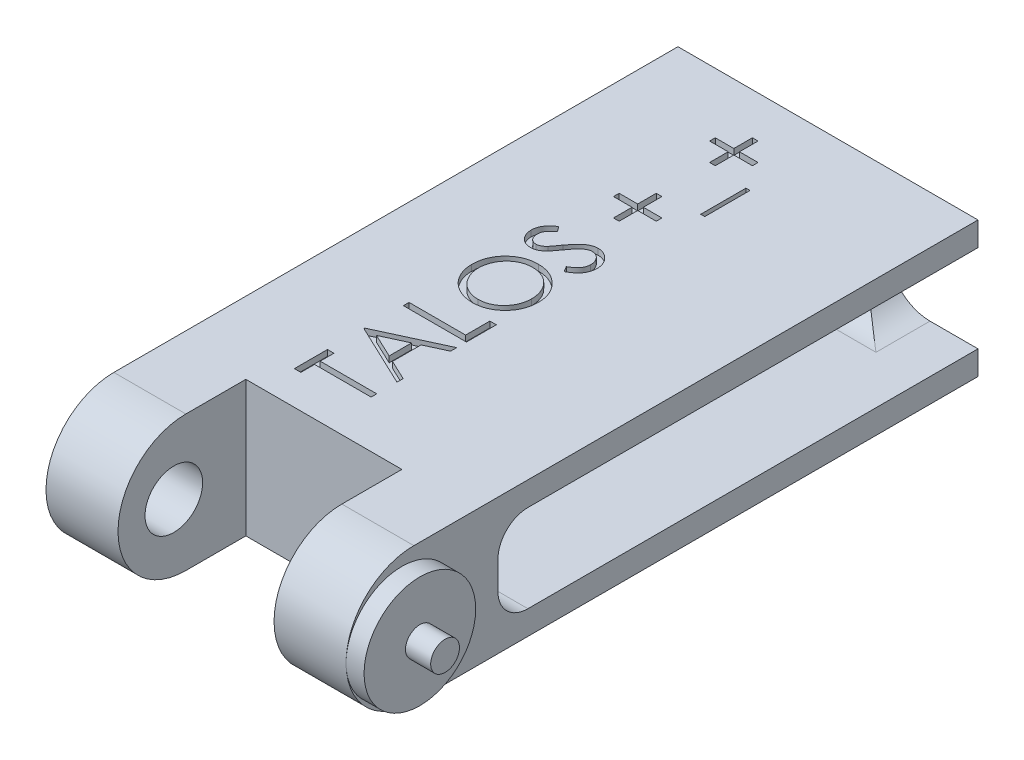
from build123d import *

# Parameters (mm, degrees)
SKETCH1_W           = 20
SKETCH1_H           = 14.6
SKETCH1_R           = 1.65
BOSS_EXTRUDE1_DEPTH = 4
SKETCH2_W           = 50
SKETCH2_H           = 80
BOSS_EXTRUDE2_DEPTH = 4
SKETCH3_W           = 50
SKETCH3_H           = 22.6
BOSS_EXTRUDE3_DEPTH = 4
SKETCH4_R           = 4.8
BOSS_EXTRUDE4_DEPTH = 12
SKETCH5_R           = 9.3
BOSS_EXTRUDE5_DEPTH = 3
SKETCH6_R           = 2.4
BOSS_EXTRUDE6_DEPTH = 4.2
FILLET1_R           = 7
FILLET2_R           = 5
FILLET3_R           = 5
SKETCH7_W           = 0.673076923
SKETCH7_H           = 7.538461539
CUT_EXTRUDE1_DEPTH  = 1


with BuildPart() as part:
    # Sketch1 → Boss-Extrude1 (new body)
    with BuildSketch(Plane.XY):
        Rectangle(SKETCH1_W, SKETCH1_H)
        with Locations((-6, 0)):
            Circle(SKETCH1_R, mode=Mode.SUBTRACT)
        with Locations((6, 0)):
            Circle(SKETCH1_R, mode=Mode.SUBTRACT)
    extrude(amount=BOSS_EXTRUDE1_DEPTH)

    # Sketch2 → Boss-Extrude2 (add)
    with BuildSketch(Plane.XZ.offset(7.3)):
        with Locations((0, 40)):
            Rectangle(SKETCH2_W, SKETCH2_H)
    boss_extrude2 = extrude(amount=BOSS_EXTRUDE2_DEPTH)

    # Mirror1: Boss-Extrude2 across plane
    add(boss_extrude2.mirror(Plane.ZX))

    # Sketch3 → Boss-Extrude3 (add)
    with BuildSketch(Plane.XY.offset(80)):
        Rectangle(SKETCH3_W, SKETCH3_H)
    extrude(amount=BOSS_EXTRUDE3_DEPTH)

    # Sketch4 → Boss-Extrude4 (add)
    with BuildSketch(Plane(origin=(25, 0, 0), x_dir=(0, 0, -1), z_dir=(1, 0, 0))):
        with BuildLine():
            Line((-84, 11.3), (-94, 11.3))
            ThreePointArc((-94, 11.3), (-105.3, 0), (-94, -11.3))
            Line((-94, -11.3), (-84, -11.3))
            Line((-84, -11.3), (-84, 11.3))
        make_face()
        with Locations((-96, 0)):
            Circle(SKETCH4_R, mode=Mode.SUBTRACT)
    boss_extrude4 = extrude(amount=-BOSS_EXTRUDE4_DEPTH)

    # Mirror2: Boss-Extrude4 across plane
    add(boss_extrude4.mirror(Plane(origin=(0, 0, 0), x_dir=(0, 0, 1), z_dir=(1, 0, 0))))

    # Sketch5 → Boss-Extrude5 (add)
    with BuildSketch(Plane(origin=(25, 0, 0), x_dir=(0, 0, -1), z_dir=(1, 0, 0))):
        with Locations(Location((-96, 0, 0), (0, 0, 179.999368251))):
            Circle(SKETCH5_R)
    extrude(amount=BOSS_EXTRUDE5_DEPTH)

    # Sketch6 → Boss-Extrude6 (add)
    with BuildSketch(Plane(origin=(28, 0, 0), x_dir=(0, 0, -1), z_dir=(1, 0, 0))):
        with Locations((-96, 0)):
            Circle(SKETCH6_R)
    extrude(amount=BOSS_EXTRUDE6_DEPTH)

    # Fillet1
    fillet1_edges = [part.edges().sort_by_distance(p)[0] for p in [
        (10, -7.3, 2),
        (-10, -7.3, 2),
        (-10, 7.3, 2),
        (10, 7.3, 2),
    ]]
    fillet(fillet1_edges, radius=FILLET1_R)

    # Fillet2
    fillet2_edges = [part.edges().sort_by_distance(p)[0] for p in [
        (0, -7.3, 4),
        (0, 7.3, 4),
    ]]
    fillet(fillet2_edges, radius=FILLET2_R)

    # Fillet3
    fillet3_edges = [part.edges().sort_by_distance(p)[0] for p in [
        (0, -7.3, 80),
        (0, 7.3, 80),
    ]]
    fillet(fillet3_edges, radius=FILLET3_R)

    # Sketch7 → Cut-Extrude1 (cut)
    # profile 1 of 8: a face of its own
    with BuildSketch(Plane(origin=(0, 11.3, 0), x_dir=(1, 0, 0), z_dir=(0, 1, 0))):
        Polygon((-9.423076923, -78.41591684), (-10.5, -78.41591684), (-10.5, -72.896686071), (-9.423076923, -72.896686071), (-9.423076923, -75.185147609), (0, -75.185147609), (0, -76.127455302), (-9.423076923, -76.127455302), align=None)
    # profile 2 of 8: a face of its own
    with BuildSketch(Plane(origin=(0, 11.3, 0), x_dir=(1, 0, 0), z_dir=(0, 1, 0))):
        Polygon((-10.5, -66.704378379), (0, -61.858224532), (0, -62.882563475), (-3.365384615, -64.434847129), (-3.365384615, -69.194762994), (0, -70.789113956), (0, -71.819762994), (-10.5, -66.838993763), align=None)
        Polygon((-8.451322115, -66.782202898), (-4.442307692, -68.68154184), (-4.442307692, -64.931241359), align=None, mode=Mode.SUBTRACT)
    # profile 3 of 8: a face of its own
    with BuildSketch(Plane(origin=(0, 11.3, 0), x_dir=(1, 0, 0), z_dir=(0, 1, 0))):
        Polygon((-10.5, -60.242839917), (-10.5, -59.300532225), (-1.076923077, -59.300532225), (-1.076923077, -55.262070686), (0, -55.262070686), (0, -60.242839917), align=None)
    # profile 4 of 8: a face of its own
    with BuildSketch(Plane(origin=(0, 11.3, 0), x_dir=(1, 0, 0), z_dir=(0, 1, 0))):
        with BuildLine():
            add(Edge.make_bspline(
                [(-10.769230769, -48.598609148), (-10.764389232, -48.404163632), (-10.754880053, -48.022256596), (-10.679685693, -47.46149203), (-10.555923645, -46.924534814), (-10.381145206, -46.411076257), (-10.154566923, -45.92306917), (-9.879339197, -45.459135291), (-9.553789417, -45.020664984), (-9.182697969, -44.610676417), (-8.77629227, -44.236671861), (-8.341227263, -43.908480922), (-7.88297286, -43.631620893), (-7.401505163, -43.404980805), (-6.897948262, -43.227053315), (-6.369479981, -43.104304818), (-5.819561625, -43.025888008), (-5.444480795, -43.016721001), (-5.254206731, -43.012070686)],
                knots=[0, 0, 0, 0, 1.065064174, 2.09187391, 3.093564831, 4.079973196, 5.057907931, 6.036227367, 7.030399151, 8.044883615, 9.061699972, 10.052012555, 11.025713132, 11.989727027, 12.962874294, 13.945865945, 14.957962116, 16, 16, 16, 16], degree=3))
            add(Edge.make_bspline(
                [(-5.254206731, -43.012070686), (-5.065335371, -43.016722566), (-4.693048039, -43.025891959), (-4.14660367, -43.104368445), (-3.621383116, -43.227601025), (-3.118557027, -43.402777821), (-2.638067209, -43.629591823), (-2.179465893, -43.906859431), (-1.743238826, -44.2344275), (-1.334033323, -44.606843841), (-0.959705032, -45.014023748), (-0.629532899, -45.447416675), (-0.35255235, -45.905658859), (-0.12338203, -46.384001553), (0.050837477, -46.886200859), (0.177675031, -47.408602264), (0.255313382, -47.954051981), (0.264540734, -48.32561713), (0.269230769, -48.514474532)],
                knots=[0, 0, 0, 0, 1.043748596, 2.057349401, 3.045489418, 4.02252776, 4.995289225, 5.97782527, 6.980224157, 8.006516136, 9.032559198, 10.034193337, 11.013412982, 11.987833483, 12.961212594, 13.946489799, 14.956251404, 16, 16, 16, 16], degree=3))
            add(Edge.make_bspline(
                [(0.269230769, -48.514474532), (0.264582609, -48.704747489), (0.255419847, -49.079826137), (0.176875632, -49.630437243), (0.054051721, -50.159270475), (-0.121476588, -50.664813529), (-0.34832828, -51.147348317), (-0.624941417, -51.607818565), (-0.95316284, -52.044376007), (-1.325662564, -52.453401247), (-1.73117722, -52.827648841), (-2.165679986, -53.153926968), (-2.620646355, -53.430602308), (-3.097338928, -53.656692306), (-3.593453256, -53.835685684), (-4.112298688, -53.957800138), (-4.650917206, -54.036807994), (-5.017645901, -54.045912534), (-5.203725962, -54.050532225)],
                knots=[0, 0, 0, 0, 1.053102029, 2.075944431, 3.073151272, 4.055350789, 5.033113405, 6.020478099, 7.024410459, 8.052272461, 9.079885166, 10.07527673, 11.055994387, 12.023226415, 12.992069828, 13.970394897, 14.97016774, 16, 16, 16, 16], degree=3))
            add(Edge.make_bspline(
                [(-5.203725962, -54.050532225), (-5.328623969, -54.048928318), (-5.576844339, -54.045740739), (-5.94544414, -54.007365662), (-6.308116113, -53.951680558), (-6.663828957, -53.871874821), (-7.011711911, -53.76749982), (-7.3541642, -53.644343737), (-7.687715371, -53.493924201), (-8.013945546, -53.323882257), (-8.327769264, -53.134096833), (-8.624408013, -52.924469585), (-8.906351003, -52.702363479), (-9.166292015, -52.458873299), (-9.411792984, -52.202023963), (-9.639081135, -51.927648829), (-9.850205988, -51.637422095), (-10.040467011, -51.330094956), (-10.212544415, -51.013240132), (-10.360209968, -50.686609798), (-10.486948153, -50.354640084), (-10.589670628, -50.01577614), (-10.670766736, -49.670917824), (-10.725988797, -49.31931247), (-10.764461751, -48.961240191), (-10.767634257, -48.720006234), (-10.769230769, -48.598609148)],
                knots=[0, 0, 0, 0, 1.037015668, 2.060948919, 3.074880161, 4.083647147, 5.086022904, 6.090072063, 7.104153813, 8.122640571, 9.144368836, 10.147691507, 11.138137339, 12.123020368, 13.103399296, 14.087645067, 15.080126199, 16.082011238, 17.087798457, 18.072939717, 19.057185487, 20.037253025, 21.01195951, 21.997135196, 22.992090687, 24, 24, 24, 24], degree=3))
        make_face()
        with BuildLine():
            add(Edge.make_bspline(
                [(-9.692307692, -48.552335109), (-9.691097258, -48.651980284), (-9.688687961, -48.850318019), (-9.656778179, -49.145152788), (-9.611624349, -49.436199527), (-9.546045155, -49.722895023), (-9.461221316, -50.005840529), (-9.358917071, -50.285161662), (-9.235267059, -50.559900722), (-9.096207597, -50.829714482), (-8.938258294, -51.088371129), (-8.770531561, -51.336493581), (-8.586795442, -51.567627964), (-8.391023509, -51.784949417), (-8.181516766, -51.987917484), (-7.959651068, -52.176442637), (-7.724466786, -52.350370279), (-7.476931803, -52.507607264), (-7.218428161, -52.647535908), (-6.953897335, -52.772819889), (-6.680230538, -52.876675529), (-6.399135533, -52.958944669), (-6.111851044, -53.028772318), (-5.81681184, -53.072573388), (-5.515035028, -53.10479758), (-5.311088303, -53.10707342), (-5.207932692, -53.108224532)],
                knots=[0, 0, 0, 0, 1.008406545, 2.007172654, 2.999155034, 3.989332444, 4.982025741, 5.988181096, 6.998684226, 8.030553839, 9.059268815, 10.065399129, 11.060956322, 12.046057109, 13.024974577, 14.012068307, 14.991706172, 15.984221787, 16.978487447, 17.966117052, 18.945677757, 19.938371053, 20.93015022, 21.936155317, 22.956113857, 24, 24, 24, 24], degree=3))
            add(Edge.make_bspline(
                [(-5.207932692, -53.108224532), (-5.056249479, -53.104391196), (-4.757841672, -53.096849838), (-4.320488036, -53.031101976), (-3.899763463, -52.929021926), (-3.498175635, -52.781025136), (-3.113933764, -52.592226027), (-2.748533179, -52.361929444), (-2.402081669, -52.088026354), (-2.07715822, -51.777079495), (-1.780705781, -51.437067301), (-1.52012253, -51.076197438), (-1.300808397, -50.697324974), (-1.117466711, -50.302633631), (-0.979344712, -49.888753605), (-0.880863792, -49.458338532), (-0.817035507, -49.011378902), (-0.810836263, -48.706801817), (-0.807692308, -48.552335109)],
                knots=[0, 0, 0, 0, 1.032022337, 2.030307203, 3.003823408, 3.974715386, 4.937372378, 5.913284036, 6.909147208, 7.938749767, 8.970518239, 9.975863271, 10.963918693, 11.946286286, 12.933361397, 13.927862637, 14.949112547, 16, 16, 16, 16], degree=3))
            add(Edge.make_bspline(
                [(-0.807692308, -48.552335109), (-0.80911767, -48.448506196), (-0.811944591, -48.242582277), (-0.840457487, -47.936301697), (-0.886089801, -47.635510591), (-0.952115465, -47.340764718), (-1.033656501, -47.051677897), (-1.134799752, -46.769122405), (-1.256046268, -46.493192091), (-1.391171499, -46.222530144), (-1.544670118, -45.963196947), (-1.710135741, -45.71657955), (-1.890629903, -45.485843375), (-2.083772536, -45.268623886), (-2.292635257, -45.067078282), (-2.513152595, -44.879089899), (-2.74883603, -44.708169515), (-2.995357169, -44.551465566), (-3.251976163, -44.409829579), (-3.517234241, -44.288169472), (-3.789708734, -44.184269224), (-4.069599836, -44.100513853), (-4.356277956, -44.034849327), (-4.650153392, -43.989611777), (-4.950631095, -43.957965864), (-5.153862707, -43.955580713), (-5.256310096, -43.954378379)],
                knots=[0, 0, 0, 0, 1.047334373, 2.07717862, 3.100662057, 4.115010574, 5.122652213, 6.129548646, 7.140165612, 8.16200981, 9.179904151, 10.178566626, 11.156366481, 12.133321541, 13.108841334, 14.082538371, 15.054589433, 16.043660176, 17.028268541, 18.009491307, 18.985652105, 19.968123554, 20.954864208, 21.950389976, 22.966808393, 24, 24, 24, 24], degree=3))
            add(Edge.make_bspline(
                [(-5.256310096, -43.954378379), (-5.358056609, -43.955581718), (-5.559889559, -43.957968762), (-5.858272014, -43.989596186), (-6.150031649, -44.034898857), (-6.434023057, -44.100186982), (-6.710318637, -44.18433744), (-6.978658863, -44.288099442), (-7.240043511, -44.410455298), (-7.493826166, -44.550880132), (-7.737351261, -44.708727002), (-7.970155229, -44.881211961), (-8.187885655, -45.071299688), (-8.395844102, -45.27360887), (-8.589870971, -45.493003461), (-8.769216575, -45.729521749), (-8.941961628, -45.977274736), (-9.094842913, -46.241865173), (-9.2367354, -46.513952478), (-9.357791469, -46.793401404), (-9.461761488, -47.076221011), (-9.546298371, -47.363542063), (-9.611373149, -47.655228752), (-9.656818587, -47.951111448), (-9.688677001, -48.250157354), (-9.691093621, -48.451289554), (-9.692307692, -48.552335109)],
                knots=[0, 0, 0, 0, 1.029877221, 2.042951179, 3.035109885, 4.018542222, 4.991021277, 5.957494829, 6.929429462, 7.911425532, 8.892163142, 9.866273635, 10.842761649, 11.81676864, 12.802607151, 13.805177466, 14.821356543, 15.858816981, 16.897175917, 17.927346774, 18.940346092, 19.946830556, 20.957962087, 21.964146003, 22.97721996, 24, 24, 24, 24], degree=3))
        make_face(mode=Mode.SUBTRACT)
    # profile 5 of 8: a face of its own
    with BuildSketch(Plane(origin=(0, 11.3, 0), x_dir=(1, 0, 0), z_dir=(0, 1, 0))):
        with BuildLine():
            Line((-2.025540865, -41.935147609), (-2.557692308, -41.047527417))
            add(Edge.make_bspline(
                [(-2.557692308, -41.047527417), (-2.419499153, -40.964972705), (-2.154726401, -40.806801063), (-1.79695228, -40.542946986), (-1.49286581, -40.269548253), (-1.244235987, -39.984580252), (-1.048489327, -39.689782408), (-0.909882632, -39.383230246), (-0.823434705, -39.065956814), (-0.812934446, -38.85003535), (-0.807692308, -38.742238956)],
                knots=[0, 0, 0, 0, 1.272034388, 2.437168799, 3.508375237, 4.49857839, 5.41946034, 6.295179144, 7.148887113, 8, 8, 8, 8], degree=3))
            add(Edge.make_bspline(
                [(-0.807692308, -38.742238956), (-0.810317324, -38.650197012), (-0.815521426, -38.467723641), (-0.86350583, -38.198566944), (-0.942008215, -37.938469913), (-1.048426697, -37.690018076), (-1.179238149, -37.45979378), (-1.333489399, -37.254672069), (-1.511721198, -37.08146853), (-1.707330898, -36.937880702), (-1.9170901, -36.826773485), (-2.133217162, -36.742797569), (-2.35867751, -36.695766534), (-2.510514979, -36.688709119), (-2.587139423, -36.685147609)],
                knots=[0, 0, 0, 0, 1.09553864, 2.171907928, 3.244545276, 4.325730702, 5.384330216, 6.391480148, 7.371786628, 8.333890167, 9.27165687, 10.191402356, 11.087295184, 12, 12, 12, 12], degree=3))
            add(Edge.make_bspline(
                [(-2.587139423, -36.685147609), (-2.674591151, -36.689475546), (-2.851690437, -36.698240091), (-3.113426688, -36.775482603), (-3.373563473, -36.893428687), (-3.534505142, -37.004284751), (-3.617788462, -37.061650013)],
                knots=[0, 0, 0, 0, 0.938992559, 1.901562324, 2.914110574, 4, 4, 4, 4], degree=3))
            add(Edge.make_bspline(
                [(-3.617788462, -37.061650013), (-3.677936536, -37.108654964), (-3.804209895, -37.207335978), (-3.992012091, -37.377129528), (-4.186122427, -37.575356348), (-4.390802305, -37.799303387), (-4.604351682, -38.049346302), (-4.828436988, -38.325581834), (-5.058479019, -38.630367494), (-5.212562677, -38.84429552), (-5.292067308, -38.954678859)],
                knots=[0, 0, 0, 0, 0.72225051, 1.516274602, 2.393638633, 3.3469932, 4.386926276, 5.505032946, 6.712638081, 8, 8, 8, 8], degree=3))
            add(Edge.make_bspline(
                [(-5.292067308, -38.954678859), (-5.370753071, -39.065150848), (-5.521194257, -39.276364878), (-5.744467109, -39.571740625), (-5.948598718, -39.835874014), (-6.135510754, -40.067591063), (-6.305228568, -40.266789854), (-6.456122386, -40.435040087), (-6.592273068, -40.568055758), (-6.680597094, -40.6420225), (-6.720252404, -40.675231744)],
                knots=[0, 0, 0, 0, 1.452282411, 2.77665338, 3.964542531, 5.026858415, 5.96415736, 6.766646006, 7.446254459, 8, 8, 8, 8], degree=3))
            add(Edge.make_bspline(
                [(-6.720252404, -40.675231744), (-6.782058582, -40.7216416), (-6.903608727, -40.812912809), (-7.093539582, -40.933521691), (-7.28759484, -41.03523149), (-7.486477799, -41.117088861), (-7.688693737, -41.183283817), (-7.895760811, -41.229306292), (-8.106273326, -41.257673573), (-8.247908924, -41.260603832), (-8.318810096, -41.262070686)],
                knots=[0, 0, 0, 0, 1.068019517, 2.100403715, 3.106014851, 4.09224787, 5.069873182, 6.043214339, 7.020455327, 8, 8, 8, 8], degree=3))
            add(Edge.make_bspline(
                [(-8.318810096, -41.262070686), (-8.429899637, -41.258155234), (-8.649704258, -41.250408018), (-8.970793598, -41.184883938), (-9.277364594, -41.081474682), (-9.566311484, -40.936554617), (-9.830374406, -40.749914963), (-10.071930177, -40.532987285), (-10.277770836, -40.277006717), (-10.45481543, -39.993617199), (-10.594823109, -39.685054903), (-10.696287163, -39.360205901), (-10.756555536, -39.021405315), (-10.764964177, -38.791557391), (-10.769230769, -38.674931263)],
                knots=[0, 0, 0, 0, 1.005248779, 1.989011071, 2.95484373, 3.928844559, 4.904706341, 5.875556129, 6.859318422, 7.868909462, 8.894684146, 9.918924798, 10.944050749, 12, 12, 12, 12], degree=3))
            add(Edge.make_bspline(
                [(-10.769230769, -38.674931263), (-10.765021063, -38.551178928), (-10.7566493, -38.30507503), (-10.682047456, -37.943647871), (-10.563315244, -37.594245033), (-10.424011254, -37.314419311), (-10.285765453, -37.09495011), (-10.159571625, -36.927744821), (-10.014592753, -36.757386267), (-9.847772458, -36.585705294), (-9.662447315, -36.411007053), (-9.457048531, -36.234096246), (-9.233427085, -36.053317292), (-9.073746754, -35.937056246), (-8.991887019, -35.877455302)],
                knots=[0, 0, 0, 0, 1.286507425, 2.558452658, 3.822738219, 5.118007103, 5.800084425, 6.519418873, 7.295692132, 8.12638276, 9.008892966, 9.945018126, 10.946518512, 12, 12, 12, 12], degree=3))
            Line((-8.991887019, -35.877455302), (-8.346153846, -36.729318282))
            add(Edge.make_bspline(
                [(-8.346153846, -36.729318282), (-8.412423752, -36.78075233), (-8.540044097, -36.879802279), (-8.71870703, -37.030240624), (-8.882129337, -37.171817526), (-9.023701018, -37.312372427), (-9.154023514, -37.44107139), (-9.263620512, -37.568199918), (-9.355954756, -37.688852103), (-9.454672351, -37.840568892), (-9.549567808, -38.032759309), (-9.632922312, -38.272005449), (-9.682372653, -38.522872432), (-9.688968568, -38.6936466), (-9.692307692, -38.780099532)],
                knots=[0, 0, 0, 0, 1.181392137, 2.275085037, 3.289537922, 4.225335853, 5.084247276, 5.86831218, 6.587234301, 7.222706459, 8.415108401, 9.595592188, 10.782789524, 12, 12, 12, 12], degree=3))
            add(Edge.make_bspline(
                [(-9.692307692, -38.780099532), (-9.688732115, -38.888594697), (-9.681836952, -39.097817401), (-9.60454983, -39.394160375), (-9.48703997, -39.662424717), (-9.317591977, -39.892369482), (-9.115577331, -40.08223131), (-8.885193854, -40.221274398), (-8.630744268, -40.304405817), (-8.453333316, -40.314580958), (-8.362980769, -40.319762994)],
                knots=[0, 0, 0, 0, 1.144248881, 2.206576175, 3.214949548, 4.222996039, 5.203671638, 6.127710127, 7.046472867, 8, 8, 8, 8], degree=3))
            add(Edge.make_bspline(
                [(-8.362980769, -40.319762994), (-8.306739234, -40.318516239), (-8.193472695, -40.316005362), (-8.026927368, -40.283920416), (-7.861260181, -40.240538932), (-7.697054196, -40.174033037), (-7.530591079, -40.081418071), (-7.359519673, -39.959927072), (-7.182366467, -39.806879531), (-7.067144058, -39.689649636), (-7.006310096, -39.627755782)],
                knots=[0, 0, 0, 0, 0.858259122, 1.72847414, 2.583651051, 3.473048463, 4.427392529, 5.488649985, 6.674082839, 8, 8, 8, 8], degree=3))
            add(Edge.make_bspline(
                [(-7.006310096, -39.627755782), (-6.985799019, -39.604771665), (-6.937069394, -39.550166664), (-6.857292552, -39.450338887), (-6.758884235, -39.318510492), (-6.637122285, -39.158123888), (-6.495877899, -38.966221803), (-6.336957063, -38.742783135), (-6.155200686, -38.490298536), (-6.028128064, -38.311132789), (-5.9609375, -38.216397609)],
                knots=[0, 0, 0, 0, 0.420754252, 0.999615792, 1.744751191, 2.668019286, 3.750313428, 4.999500688, 6.413464383, 8, 8, 8, 8], degree=3))
            add(Edge.make_bspline(
                [(-5.9609375, -38.216397609), (-5.878013363, -38.10243995), (-5.717442264, -37.881776737), (-5.476196016, -37.56780291), (-5.240249997, -37.283125209), (-5.01112629, -37.02672309), (-4.790511656, -36.796134024), (-4.575922943, -36.593682484), (-4.368767393, -36.418449899), (-4.104987131, -36.227223142), (-3.778021839, -36.034140805), (-3.377247114, -35.868588571), (-2.975322291, -35.763267074), (-2.705529583, -35.749588717), (-2.572415865, -35.742839917)],
                knots=[0, 0, 0, 0, 1.163604038, 2.253157948, 3.268574773, 4.215621239, 5.091738613, 5.902582348, 6.650434646, 7.330118262, 8.591011492, 9.77460283, 10.902005569, 12, 12, 12, 12], degree=3))
            add(Edge.make_bspline(
                [(-2.572415865, -35.742839917), (-2.478281767, -35.744813341), (-2.291841592, -35.748721866), (-2.01806186, -35.793575388), (-1.752223181, -35.859443051), (-1.497874447, -35.957920682), (-1.250934566, -36.08007627), (-1.016055404, -36.232857739), (-0.788673766, -36.410877067), (-0.575164338, -36.614981685), (-0.378921664, -36.838204698), (-0.205076145, -37.07498525), (-0.056784524, -37.322851566), (0.061315211, -37.584487871), (0.154304665, -37.857083497), (0.221491519, -38.141537364), (0.262772693, -38.438137619), (0.267054045, -38.639740203), (0.269230769, -38.742238956)],
                knots=[0, 0, 0, 0, 0.983922938, 1.948738757, 2.895227473, 3.844781104, 4.796118043, 5.772795661, 6.770647148, 7.813532943, 8.8582745, 9.876489951, 10.882905461, 11.874265028, 12.874055871, 13.891769171, 14.928133632, 16, 16, 16, 16], degree=3))
            add(Edge.make_bspline(
                [(0.269230769, -38.742238956), (0.267697224, -38.821544984), (0.264649448, -38.979158264), (0.237705609, -39.212286713), (0.199584288, -39.440705469), (0.139062115, -39.661548358), (0.065631048, -39.877660433), (-0.024783438, -40.088102737), (-0.133136983, -40.292973624), (-0.257014603, -40.49343511), (-0.401216841, -40.688923634), (-0.569021697, -40.877817586), (-0.756150195, -41.065086241), (-0.965493151, -41.249401177), (-1.199352613, -41.426741225), (-1.454245148, -41.60136375), (-1.73092875, -41.772417736), (-1.925502582, -41.879891168), (-2.025540865, -41.935147609)],
                knots=[0, 0, 0, 0, 0.915313873, 1.819100311, 2.706792138, 3.586475221, 4.459428225, 5.3405999, 6.2277379, 7.133009489, 8.059106158, 9.028520402, 10.047404263, 11.114294124, 12.246039232, 13.433834781, 14.680630578, 16, 16, 16, 16], degree=3))
        make_face()
    # profile 6 of 8: a face of its own
    with BuildSketch(Plane(origin=(0, 11.3, 0), x_dir=(1, 0, 0), z_dir=(0, 1, 0))):
        Polygon((-5.653846154, -26.992839917), (-8.75, -26.992839917), (-8.75, -26.050532225), (-5.653846154, -26.050532225), (-5.653846154, -22.954378379), (-4.711538462, -22.954378379), (-4.711538462, -26.050532225), (-1.615384615, -26.050532225), (-1.615384615, -26.992839917), (-4.711538462, -26.992839917), (-4.711538462, -30.088993763), (-5.653846154, -30.088993763), align=None)
    # profile 7 of 8: a face of its own
    with BuildSketch(Plane(origin=(0, 11.3, 0), x_dir=(1, 0, 0), z_dir=(0, 1, 0))):
        with Locations((1.413461539, -18.512070687)):
            Rectangle(SKETCH7_W, SKETCH7_H)
    # profile 8 of 8: a face of its own
    with BuildSketch(Plane(origin=(0, 11.3, 0), x_dir=(1, 0, 0), z_dir=(0, 1, 0))):
        Polygon((-5.653846154, -10.973609148), (-8.75, -10.973609148), (-8.75, -10.031301456), (-5.653846154, -10.031301456), (-5.653846154, -6.935147609), (-4.711538462, -6.935147609), (-4.711538462, -10.031301456), (-1.615384615, -10.031301456), (-1.615384615, -10.973609148), (-4.711538462, -10.973609148), (-4.711538462, -14.069762994), (-5.653846154, -14.069762994), align=None)
    extrude(amount=-CUT_EXTRUDE1_DEPTH, mode=Mode.SUBTRACT)


solid = part.part
